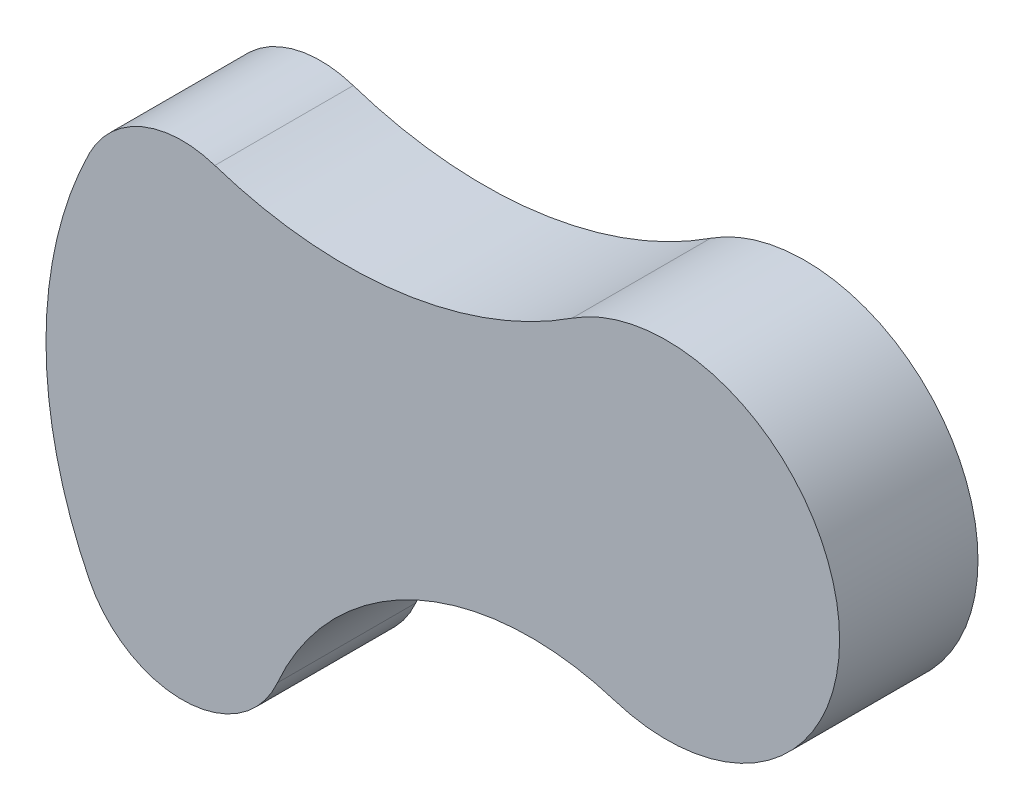
from build123d import *

# Parameters (mm, degrees)
SALIENTE_EXTRUIR1_DEPTH = 10


with BuildPart() as part:
    # Croquis1 → Saliente-Extruir1 (new body)
    with BuildSketch(Plane.XY):
        with BuildLine():
            ThreePointArc((-3.765943471, -11.91921431), (12.384736399, 1.693606895), (-6.827731092, 10.470534281))
            ThreePointArc((-6.827731092, 10.470534281), (-19.352943462, 5.849353769), (-32.642857143, 7.119963311))
            ThreePointArc((-32.642857143, 7.119963311), (-37.887924102, 6.921697363), (-41.718548124, 3.333333333))
            ThreePointArc((-41.718548124, 3.333333333), (-44.844355629, -10), (-41.718548124, -23.333333333))
            ThreePointArc((-41.718548124, -23.333333333), (-34.814635494, -27.497708983), (-28.124941734, -22.997261056))
            ThreePointArc((-28.124941734, -22.997261056), (-18.071088744, -12.784253915), (-3.765943471, -11.91921431))
        make_face()
    extrude(amount=SALIENTE_EXTRUIR1_DEPTH)


solid = part.part
